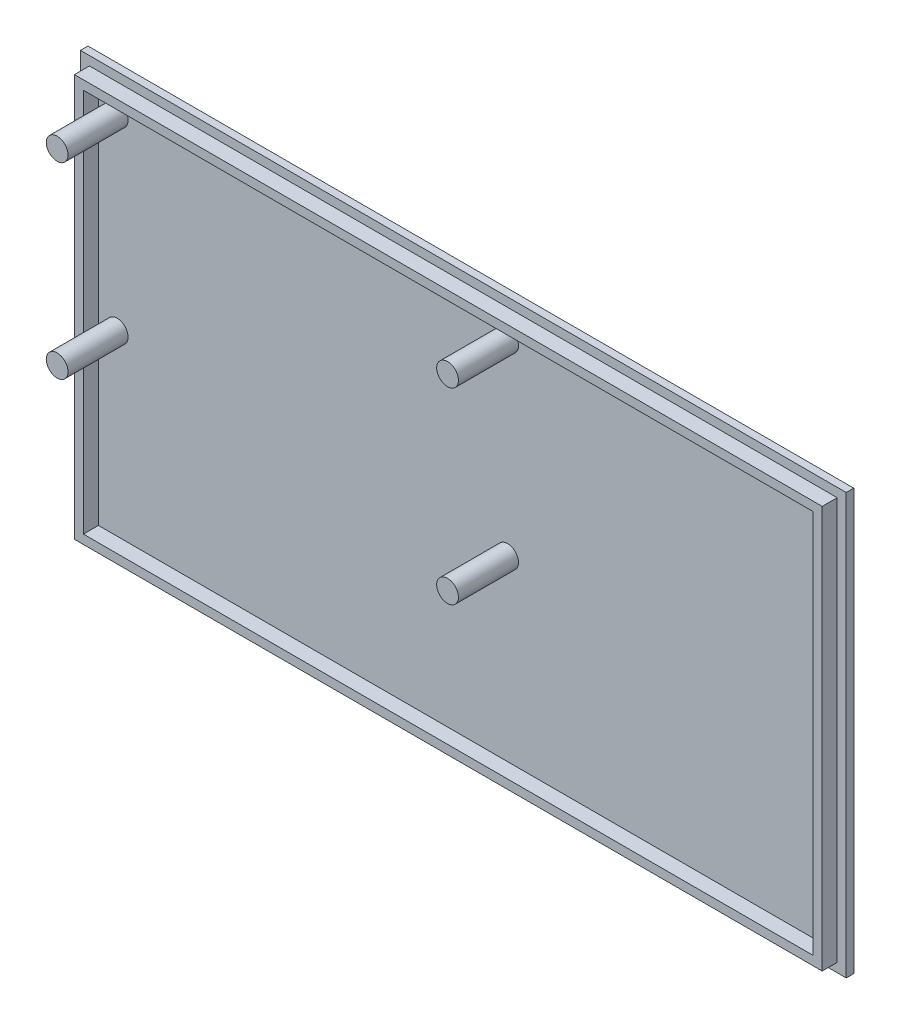
from build123d import *

# Parameters (mm, degrees)
SKETCH1_W        = 102
SKETCH1_H        = 56
PANEL_DEPTH      = 1
SKETCH2_W        = 99.6
SKETCH2_H        = 53.6
SKETCH2_W_2      = 97.2
SKETCH2_H_2      = 51.2
MOUNTS_DEPTH     = 2
SKETCH3_R        = 1.45
ESP_MOUNTS_DEPTH = 8


with BuildPart() as part:
    # Sketch1 → PANEL (new body)
    with BuildSketch(Plane.XY):
        Rectangle(SKETCH1_W, SKETCH1_H)
    extrude(amount=PANEL_DEPTH)

    # Sketch2 → MOUNTS (add)
    with BuildSketch(Plane.XY.offset(1)):
        Rectangle(SKETCH2_W, SKETCH2_H)
        Rectangle(SKETCH2_W_2, SKETCH2_H_2, mode=Mode.SUBTRACT)
    extrude(amount=MOUNTS_DEPTH)

    # Sketch3 → ESP_MOUNTS (add)
    with BuildSketch(Plane.XY.offset(1)):
        with Locations(Location((-46.1, 23.1, 0), (0, 0, 180))):
            Circle(SKETCH3_R)
        with Locations(Location((-46.1, -1.9, 0), (0, 0, 180))):
            Circle(SKETCH3_R)
        with Locations(Location((5.9, 23.1, 0), (0, 0, 180))):
            Circle(SKETCH3_R)
        with Locations(Location((5.9, -1.9, 0), (0, 0, 180))):
            Circle(SKETCH3_R)
    extrude(amount=ESP_MOUNTS_DEPTH)


solid = part.part
